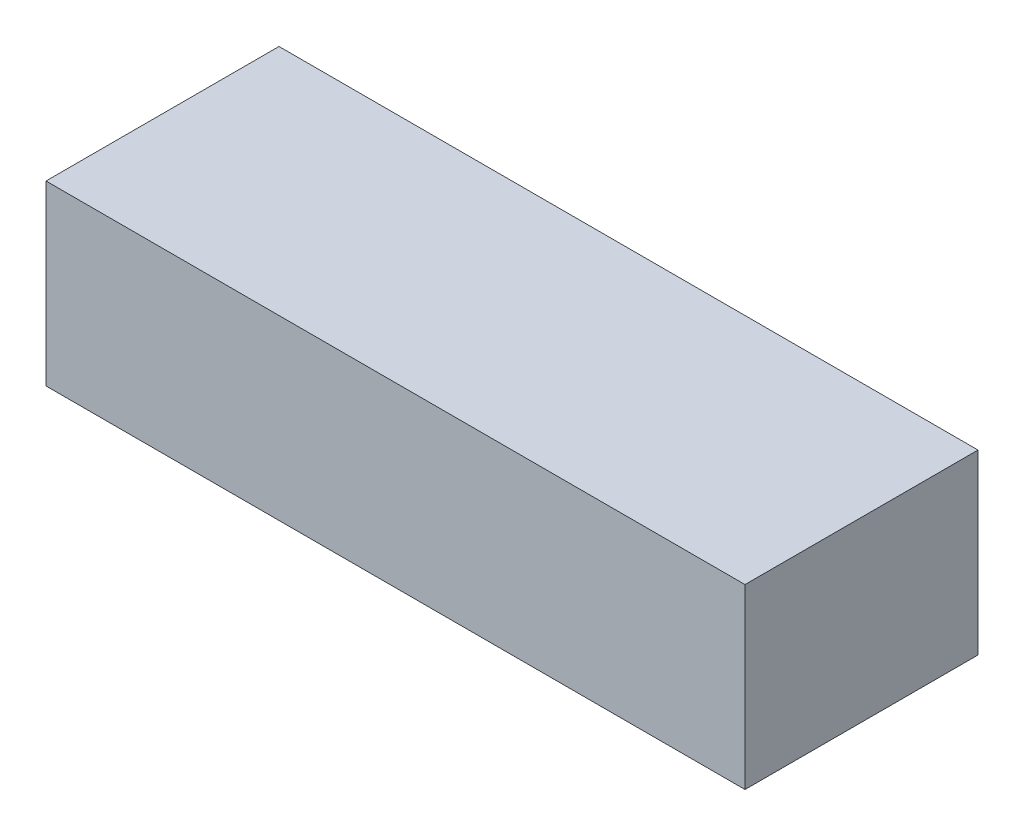
from build123d import *

# Parameters (mm, degrees)
ESBO_O1_W                = 63
ESBO_O1_H                = 16
RESSALTO_EXTRUS_O1_DEPTH = 21


with BuildPart() as part:
    # Esboço1 → Ressalto-extrusão1 (new body)
    with BuildSketch(Plane.XY):
        with Locations((31.5, 8)):
            Rectangle(ESBO_O1_W, ESBO_O1_H)
    extrude(amount=RESSALTO_EXTRUS_O1_DEPTH)


solid = part.part
